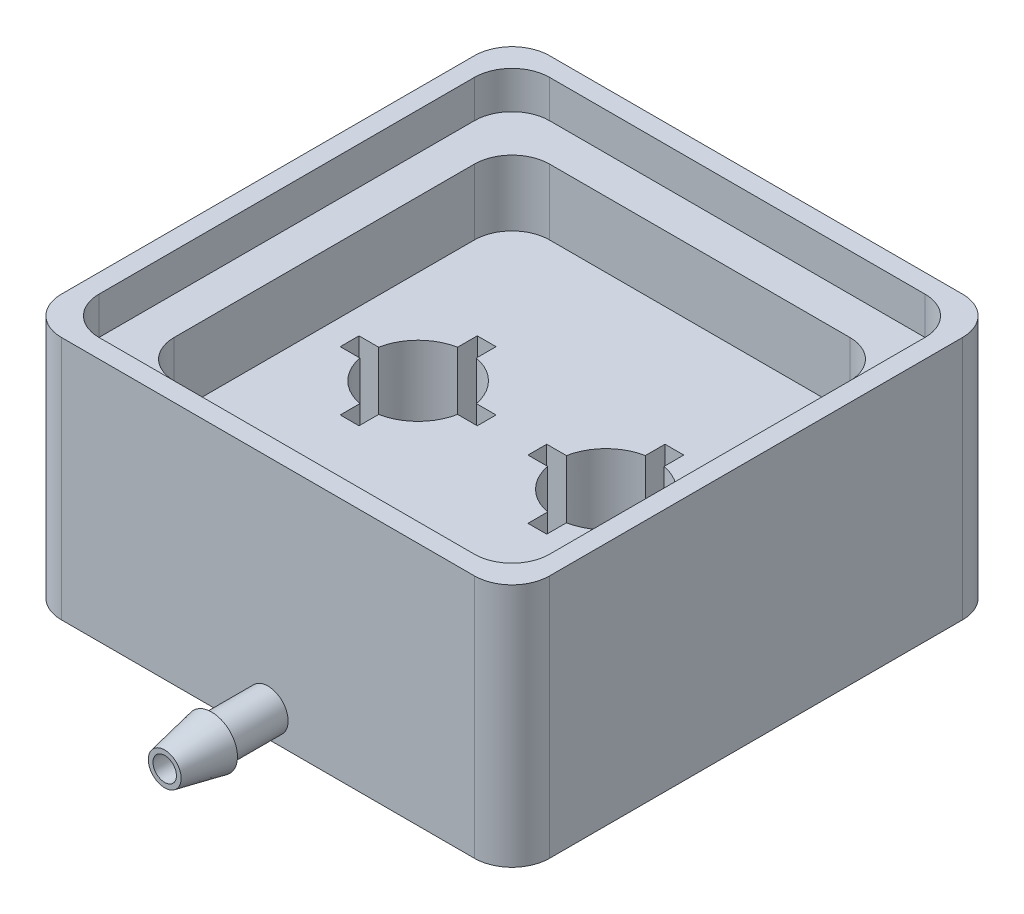
from build123d import *

# Parameters (mm, degrees)
SKETCH1_R                      = 2.65
BOSS_EXTRUDE1_DEPTH            = 7.53
CUT_EXTRUDE1_START             = -6.785
CUT_EXTRUDE1_DEPTH             = 6.785
CUT_EXTRUDE3_REACH             = 25.832
SKETCH10_R                     = 0.625
CUT_EXTRUDE3_DIRECTION_2_REACH = 25.832
CUT_EXTRUDE2_REACH             = 32.028
SKETCH5_R                      = 0.625
BOSS_EXTRUDE2_DEPTH            = 3.5
BOSS_EXTRUDE3_DEPTH            = 2


with BuildPart() as part:
    # Sketch1 → Boss-Extrude1 (new body)
    with BuildSketch(Plane(origin=(0, 0, 0), x_dir=(1, 0, 0), z_dir=(0, 1, 0))):
        with BuildLine():
            Line((-11, -13), (11, -13))
            ThreePointArc((11, -13), (12.414213562, -12.414213562), (13, -11))
            Line((13, -11), (13, 11))
            ThreePointArc((13, 11), (12.414213562, 12.414213562), (11, 13))
            Line((11, 13), (-11, 13))
            ThreePointArc((-11, 13), (-12.414213562, 12.414213562), (-13, 11))
            Line((-13, 11), (-13, -11))
            ThreePointArc((-13, -11), (-12.414213562, -12.414213562), (-11, -13))
        make_face()
        with Locations(Location((5, 0, 0), (0, 0, 270))):
            Circle(SKETCH1_R, mode=Mode.SUBTRACT)
        with Locations(Location((-5, 0, 0), (0, 0, 270))):
            Circle(SKETCH1_R, mode=Mode.SUBTRACT)
    extrude(amount=BOSS_EXTRUDE1_DEPTH)

    # Sketch2 → Cut-Extrude1 (cut)
    with BuildSketch(Plane(origin=(0, 7.53, 0), x_dir=(1, 0, 0), z_dir=(0, 1, 0)).offset(CUT_EXTRUDE1_START)):
        with BuildLine():
            Line((4.5, 3.65), (4.5, 2.602402736))
            ThreePointArc((4.5, 2.602402736), (5, 2.65), (5.5, 2.602402736))
            Line((5.5, 2.602402736), (5.5, 3.65))
            Line((5.5, 3.65), (4.5, 3.65))
        make_face()
        with BuildLine():
            ThreePointArc((7.65, 0), (7.638073848, -0.251130195), (7.602402736, -0.5))
            Line((7.602402736, -0.5), (8.65, -0.5))
            Line((8.65, -0.5), (8.65, 0.5))
            Line((8.65, 0.5), (7.602402736, 0.5))
            ThreePointArc((7.602402736, 0.5), (7.638073848, 0.251130195), (7.65, 0))
        make_face()
        with BuildLine():
            Line((4.5, -2.602402736), (4.5, -3.65))
            Line((4.5, -3.65), (5.5, -3.65))
            Line((5.5, -3.65), (5.5, -2.602402736))
            ThreePointArc((5.5, -2.602402736), (5, -2.65), (4.5, -2.602402736))
        make_face()
        with BuildLine():
            Line((1.35, -0.5), (2.397597264, -0.5))
            ThreePointArc((2.397597264, -0.5), (2.35, 0), (2.397597264, 0.5))
            Line((2.397597264, 0.5), (1.35, 0.5))
            Line((1.35, 0.5), (1.35, -0.5))
        make_face()
        with BuildLine():
            ThreePointArc((-2.35, 0), (-2.361926152, -0.251130195), (-2.397597264, -0.5))
            Line((-2.397597264, -0.5), (-1.35, -0.5))
            Line((-1.35, -0.5), (-1.35, 0.5))
            Line((-1.35, 0.5), (-2.397597264, 0.5))
            ThreePointArc((-2.397597264, 0.5), (-2.361926152, 0.251130195), (-2.35, 0))
        make_face()
        with BuildLine():
            Line((-5.5, 3.65), (-5.5, 2.602402736))
            ThreePointArc((-5.5, 2.602402736), (-5, 2.65), (-4.5, 2.602402736))
            Line((-4.5, 2.602402736), (-4.5, 3.65))
            Line((-4.5, 3.65), (-5.5, 3.65))
        make_face()
        with BuildLine():
            Line((-8.65, 0.5), (-8.65, -0.5))
            Line((-8.65, -0.5), (-7.602402736, -0.5))
            ThreePointArc((-7.602402736, -0.5), (-7.65, 0), (-7.602402736, 0.5))
            Line((-7.602402736, 0.5), (-8.65, 0.5))
        make_face()
        with BuildLine():
            ThreePointArc((-4.5, -2.602402736), (-5, -2.65), (-5.5, -2.602402736))
            Line((-5.5, -2.602402736), (-5.5, -3.65))
            Line((-5.5, -3.65), (-4.5, -3.65))
            Line((-4.5, -3.65), (-4.5, -2.602402736))
        make_face()
    extrude(amount=CUT_EXTRUDE1_DEPTH, mode=Mode.SUBTRACT)

    # Sketch3 → Revolve1 (revolve)
    with BuildSketch(Plane(origin=(0, 0, 0), x_dir=(0, 0, -1), z_dir=(1, 0, 0)), mode=Mode.PRIVATE) as revolve1_sk:
        Polygon((-13, 0.3), (-16, 0.3), (-16, 0), (-18.5, 0.5), (-18.5, 0.75), (-13, 0.75), align=None)
    revolve(revolve1_sk.sketch.rotate(Axis((0, 1.375, 13), (0, 0, 1)), 180), axis=Axis((0, 1.375, 13), (0, 0, 1)))

    # Sketch10 → Cut-Extrude3 (cut, up to next)
    with BuildSketch(Plane(origin=(0, 0, 0), x_dir=(0, 0, -1), z_dir=(1, 0, 0)), mode=Mode.PRIVATE) as cut_extrude3_sk1:
        with Locations(Location((0, 1.375, 0), (0, 0, 143.130102406))):
            Circle(SKETCH10_R)
    cut_extrude3_tool1 = extrude(cut_extrude3_sk1.sketch, amount=-CUT_EXTRUDE3_REACH, mode=Mode.PRIVATE) & part.part
    add(cut_extrude3_tool1.solids().sort_by_distance((0, 1.375, 0))[0], mode=Mode.SUBTRACT)

    # Sketch10 → Cut-Extrude3 direction 2 (cut, up to next)
    with BuildSketch(Plane(origin=(0, 0, 0), x_dir=(0, 0, -1), z_dir=(1, 0, 0)), mode=Mode.PRIVATE) as cut_extrude3_direction_2_sk1:
        with Locations(Location((0, 1.375, 0), (0, 0, 143.130102406))):
            Circle(SKETCH10_R)
    cut_extrude3_direction_2_tool1 = extrude(cut_extrude3_direction_2_sk1.sketch, amount=CUT_EXTRUDE3_DIRECTION_2_REACH, mode=Mode.PRIVATE) & part.part
    add(cut_extrude3_direction_2_tool1.solids().sort_by_distance((0, 1.375, 0))[0], mode=Mode.SUBTRACT)

    # Sketch5 → Cut-Extrude2 (cut, up to next)
    with BuildSketch(Plane.XY.offset(13), mode=Mode.PRIVATE) as cut_extrude2_sk1:
        with Locations(Location((0, 1.375, 0), (0, 0, 90))):
            Circle(SKETCH5_R)
    cut_extrude2_tool1 = extrude(cut_extrude2_sk1.sketch, amount=-CUT_EXTRUDE2_REACH, mode=Mode.PRIVATE) & part.part
    add(cut_extrude2_tool1.solids().sort_by_distance((0, 1.375, 13))[0], mode=Mode.SUBTRACT)

    # Sketch6 → Boss-Extrude2 (add)
    with BuildSketch(Plane(origin=(0, 7.53, 0), x_dir=(1, 0, 0), z_dir=(0, 1, 0))):
        with BuildLine():
            Line((-11, -13), (11, -13))
            ThreePointArc((11, -13), (12.414213562, -12.414213562), (13, -11))
            Line((13, -11), (13, 11))
            ThreePointArc((13, 11), (12.414213562, 12.414213562), (11, 13))
            Line((11, 13), (-11, 13))
            ThreePointArc((-11, 13), (-12.414213562, 12.414213562), (-13, 11))
            Line((-13, 11), (-13, -11))
            ThreePointArc((-13, -11), (-12.414213562, -12.414213562), (-11, -13))
        make_face()
        with BuildLine():
            Line((-8, -10), (8, -10))
            ThreePointArc((8, -10), (9.414213562, -9.414213562), (10, -8))
            Line((10, -8), (10, 8))
            ThreePointArc((10, 8), (9.414213562, 9.414213562), (8, 10))
            Line((8, 10), (-8, 10))
            ThreePointArc((-8, 10), (-9.414213562, 9.414213562), (-10, 8))
            Line((-10, 8), (-10, -8))
            ThreePointArc((-10, -8), (-9.414213562, -9.414213562), (-8, -10))
        make_face(mode=Mode.SUBTRACT)
    extrude(amount=BOSS_EXTRUDE2_DEPTH)

    # Sketch8 → Boss-Extrude3 (add)
    with BuildSketch(Plane(origin=(0, 11.03, 0), x_dir=(1, 0, 0), z_dir=(0, 1, 0))):
        with BuildLine():
            Line((-11, -13), (11, -13))
            ThreePointArc((11, -13), (12.414213562, -12.414213562), (13, -11))
            Line((13, -11), (13, 11))
            ThreePointArc((13, 11), (12.414213562, 12.414213562), (11, 13))
            Line((11, 13), (-11, 13))
            ThreePointArc((-11, 13), (-12.414213562, 12.414213562), (-13, 11))
            Line((-13, 11), (-13, -11))
            ThreePointArc((-13, -11), (-12.414213562, -12.414213562), (-11, -13))
        make_face()
        with BuildLine():
            Line((-10, -12), (10, -12))
            ThreePointArc((10, -12), (11.414213562, -11.414213562), (12, -10))
            Line((12, -10), (12, 10))
            ThreePointArc((12, 10), (11.414213562, 11.414213562), (10, 12))
            Line((10, 12), (-10, 12))
            ThreePointArc((-10, 12), (-11.414213562, 11.414213562), (-12, 10))
            Line((-12, 10), (-12, -10))
            ThreePointArc((-12, -10), (-11.414213562, -11.414213562), (-10, -12))
        make_face(mode=Mode.SUBTRACT)
    extrude(amount=BOSS_EXTRUDE3_DEPTH)


solid = part.part
